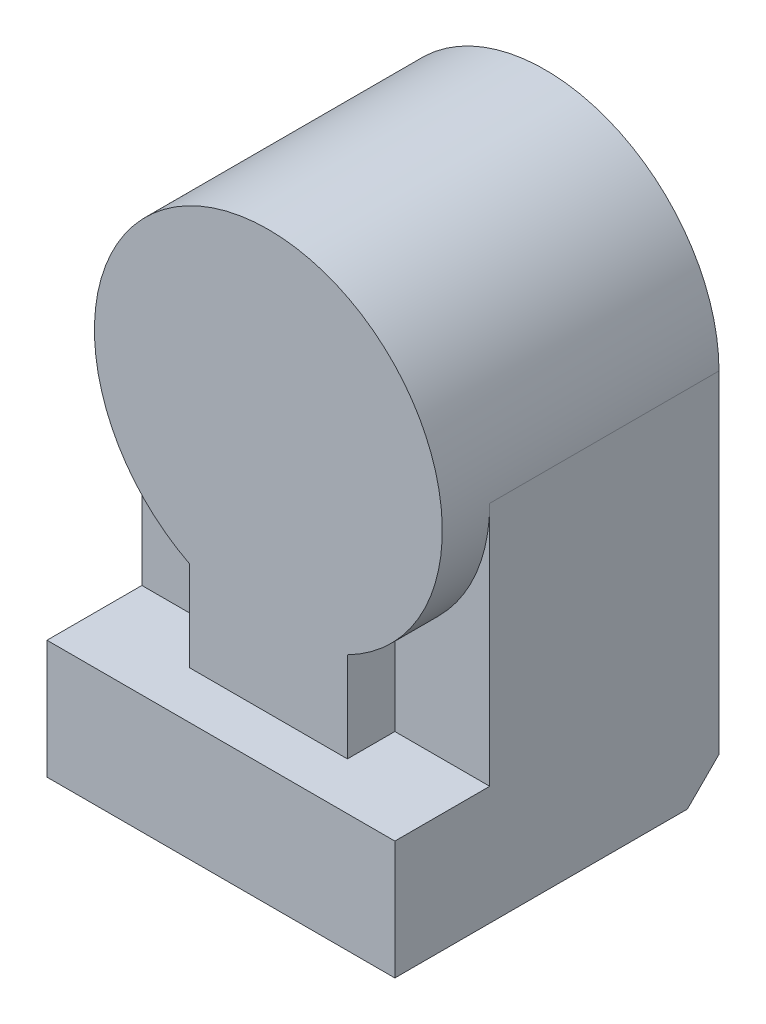
from build123d import *

# Parameters (mm, degrees)
BOSS_EXTRU_1_DEPTH = 14.5
CHANFREIN1_SIZE    = 2
ESQUISSE2_W        = 22
ESQUISSE2_H        = 7.5
BOSS_EXTRU_2_DEPTH = 6
BOSS_EXTRU_3_DEPTH = 3


with BuildPart() as part:
    # Esquisse1 → Boss.-Extru.1 (new body)
    with BuildSketch(Plane.XY):
        with BuildLine():
            Line((-11, 0), (-11, -23))
            Line((-11, -23), (11, -23))
            Line((11, -23), (11, 0))
            ThreePointArc((11, 0), (0, 11), (-11, 0))
        make_face()
    extrude(amount=BOSS_EXTRU_1_DEPTH)

    # Chanfrein1
    chanfrein1_edges = [part.edges().sort_by_distance(p)[0] for p in [
        (0, -23, 0),
    ]]
    chamfer(chanfrein1_edges, length=CHANFREIN1_SIZE)

    # Esquisse2 → Boss.-Extru.2 (add)
    with BuildSketch(Plane.XY.offset(14.5)):
        with Locations((0, -19.25)):
            Rectangle(ESQUISSE2_W, ESQUISSE2_H)
    extrude(amount=BOSS_EXTRU_2_DEPTH)

    # Esquisse3 → Boss.-Extru.3 (add)
    with BuildSketch(Plane.XY.offset(14.5)):
        with BuildLine():
            Line((-5, -9.797958971), (-5, -15.5))
            Line((-5, -15.5), (5, -15.5))
            Line((5, -15.5), (5, -9.797958971))
            ThreePointArc((5, -9.797958971), (0, 11), (-5, -9.797958971))
        make_face()
    extrude(amount=BOSS_EXTRU_3_DEPTH)


solid = part.part
